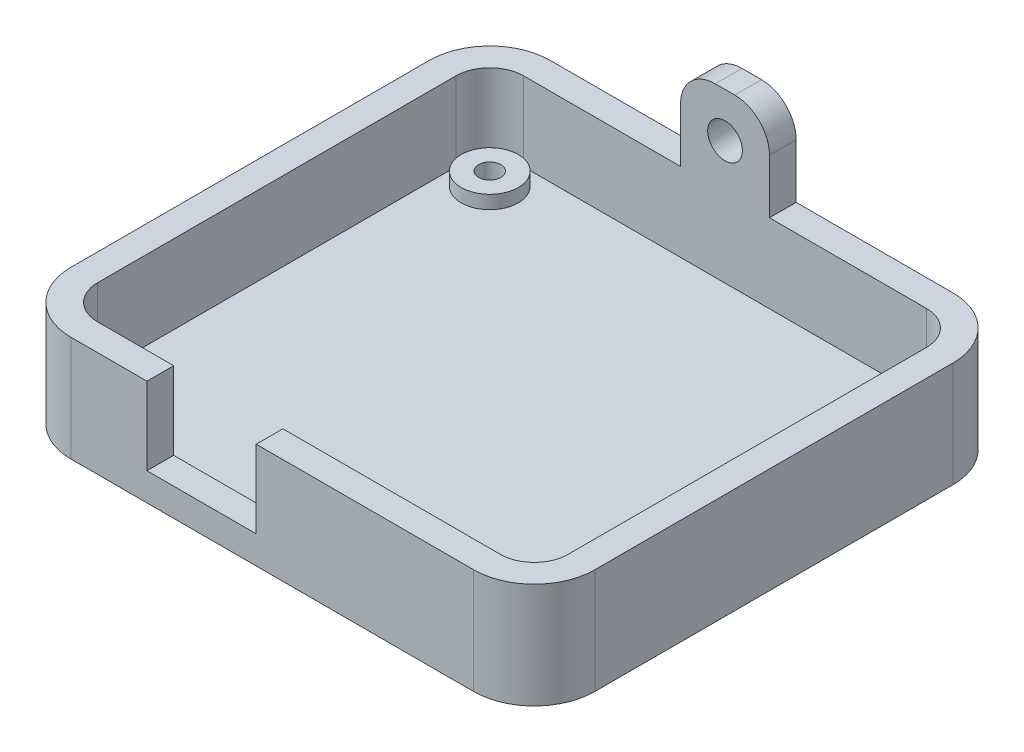
from build123d import *

# Parameters (mm, degrees)
BOSS_EXTRUDE1_DEPTH = 3
CUT_EXTRUDE1_REACH  = 77.661
SKETCH1_3_R         = 1.25
BOSS_EXTRUDE2_START = 8.86
BOSS_EXTRUDE2_DEPTH = 8.86
BOSS_EXTRUDE3_START = 1.5
SKETCH1_5_R         = 3.21
SKETCH1_5_R_2       = 1.25
BOSS_EXTRUDE3_DEPTH = 1.5
SKETCH2_W           = 12.28
SKETCH2_H           = 8.73
CUT_EXTRUDE2_DEPTH  = 3
SKETCH5_R           = 1.95
BOSS_EXTRUDE5_DEPTH = 3


with BuildPart() as part:
    # Sketch1 → Boss-Extrude1 (new body)
    with BuildSketch(Plane(origin=(0, 0, 0), x_dir=(1, 0, 0), z_dir=(0, 1, 0))):
        with BuildLine():
            Line((3.81, 3), (49.09, 3))
            ThreePointArc((49.09, 3), (53.90539718, 1.00539718), (55.9, -3.81))
            Line((55.9, -3.81), (55.9, -44.09))
            ThreePointArc((55.9, -44.09), (53.90539718, -48.90539718), (49.09, -50.9))
            Line((49.09, -50.9), (3.81, -50.9))
            ThreePointArc((3.81, -50.9), (-1.00539718, -48.90539718), (-3, -44.09))
            Line((-3, -44.09), (-3, -3.81))
            ThreePointArc((-3, -3.81), (-1.00539718, 1.00539718), (3.81, 3))
        make_face()
    extrude(amount=-BOSS_EXTRUDE1_DEPTH)

    # Sketch1<3> → Cut-Extrude1 (cut, up to next)
    with BuildSketch(Plane(origin=(0, 0, 0), x_dir=(1, 0, 0), z_dir=(0, 1, 0)), mode=Mode.PRIVATE) as cut_extrude1_sk1:
        with Locations((49.09, -44.09)):
            Circle(SKETCH1_3_R)
    cut_extrude1_tool1 = extrude(cut_extrude1_sk1.sketch, amount=-CUT_EXTRUDE1_REACH, mode=Mode.PRIVATE) & part.part
    # Sketch1<3> → Cut-Extrude1 (cut, up to next)
    with BuildSketch(Plane(origin=(0, 0, 0), x_dir=(1, 0, 0), z_dir=(0, 1, 0)), mode=Mode.PRIVATE) as cut_extrude1_sk2:
        with Locations((3.81, -44.09)):
            Circle(SKETCH1_3_R)
    cut_extrude1_tool2 = extrude(cut_extrude1_sk2.sketch, amount=-CUT_EXTRUDE1_REACH, mode=Mode.PRIVATE) & part.part
    # Sketch1<3> → Cut-Extrude1 (cut, up to next)
    with BuildSketch(Plane(origin=(0, 0, 0), x_dir=(1, 0, 0), z_dir=(0, 1, 0)), mode=Mode.PRIVATE) as cut_extrude1_sk3:
        with Locations((3.81, -3.81)):
            Circle(SKETCH1_3_R)
    cut_extrude1_tool3 = extrude(cut_extrude1_sk3.sketch, amount=-CUT_EXTRUDE1_REACH, mode=Mode.PRIVATE) & part.part
    # Sketch1<3> → Cut-Extrude1 (cut, up to next)
    with BuildSketch(Plane(origin=(0, 0, 0), x_dir=(1, 0, 0), z_dir=(0, 1, 0)), mode=Mode.PRIVATE) as cut_extrude1_sk4:
        with Locations((49.09, -3.81)):
            Circle(SKETCH1_3_R)
    cut_extrude1_tool4 = extrude(cut_extrude1_sk4.sketch, amount=-CUT_EXTRUDE1_REACH, mode=Mode.PRIVATE) & part.part
    add(cut_extrude1_tool1.solids().sort_by_distance((49.09, 0, 44.09))[0], mode=Mode.SUBTRACT)
    add(cut_extrude1_tool2.solids().sort_by_distance((3.81, 0, 44.09))[0], mode=Mode.SUBTRACT)
    add(cut_extrude1_tool3.solids().sort_by_distance((3.81, 0, 3.81))[0], mode=Mode.SUBTRACT)
    add(cut_extrude1_tool4.solids().sort_by_distance((49.09, 0, 3.81))[0], mode=Mode.SUBTRACT)

    # Sketch1<4> → Boss-Extrude2 (add)
    with BuildSketch(Plane(origin=(0, 0, 0), x_dir=(1, 0, 0), z_dir=(0, 1, 0)).offset(BOSS_EXTRUDE2_START)):
        with BuildLine():
            Line((49.09, 3), (3.81, 3))
            ThreePointArc((3.81, 3), (-1.00539718, 1.00539718), (-3, -3.81))
            Line((-3, -3.81), (-3, -44.09))
            ThreePointArc((-3, -44.09), (-1.00539718, -48.90539718), (3.81, -50.9))
            Line((3.81, -50.9), (49.09, -50.9))
            ThreePointArc((49.09, -50.9), (53.90539718, -48.90539718), (55.9, -44.09))
            Line((55.9, -44.09), (55.9, -3.81))
            ThreePointArc((55.9, -3.81), (53.90539718, 1.00539718), (49.09, 3))
        make_face()
        with BuildLine():
            ThreePointArc((0, -3.81), (1.115923164, -1.115923164), (3.81, 0))
            Line((3.81, 0), (49.09, 0))
            ThreePointArc((49.09, 0), (51.784076836, -1.115923164), (52.9, -3.81))
            Line((52.9, -3.81), (52.9, -44.09))
            ThreePointArc((52.9, -44.09), (51.784076836, -46.784076836), (49.09, -47.9))
            Line((49.09, -47.9), (3.81, -47.9))
            ThreePointArc((3.81, -47.9), (1.115923164, -46.784076836), (0, -44.09))
            Line((0, -44.09), (0, -3.81))
        make_face(mode=Mode.SUBTRACT)
    extrude(amount=-BOSS_EXTRUDE2_DEPTH)

    # Sketch1<5> → Boss-Extrude3 (add)
    # profile 1 of 4: a face of its own
    with BuildSketch(Plane(origin=(0, 0, 0), x_dir=(1, 0, 0), z_dir=(0, 1, 0)).offset(BOSS_EXTRUDE3_START)):
        with Locations((3.81, -3.81)):
            Circle(SKETCH1_5_R)
        with Locations((3.81, -3.81)):
            Circle(SKETCH1_5_R_2, mode=Mode.SUBTRACT)
    # profile 2 of 4: a face of its own
    with BuildSketch(Plane(origin=(0, 0, 0), x_dir=(1, 0, 0), z_dir=(0, 1, 0)).offset(BOSS_EXTRUDE3_START)):
        with Locations((49.09, -3.81)):
            Circle(SKETCH1_5_R)
        with Locations((49.09, -3.81)):
            Circle(SKETCH1_5_R_2, mode=Mode.SUBTRACT)
    # profile 3 of 4: a face of its own
    with BuildSketch(Plane(origin=(0, 0, 0), x_dir=(1, 0, 0), z_dir=(0, 1, 0)).offset(BOSS_EXTRUDE3_START)):
        with Locations((49.09, -44.09)):
            Circle(SKETCH1_5_R)
        with Locations((49.09, -44.09)):
            Circle(SKETCH1_5_R_2, mode=Mode.SUBTRACT)
    # profile 4 of 4: a face of its own
    with BuildSketch(Plane(origin=(0, 0, 0), x_dir=(1, 0, 0), z_dir=(0, 1, 0)).offset(BOSS_EXTRUDE3_START)):
        with Locations((3.81, -44.09)):
            Circle(SKETCH1_5_R)
        with Locations((3.81, -44.09)):
            Circle(SKETCH1_5_R_2, mode=Mode.SUBTRACT)
    extrude(amount=-BOSS_EXTRUDE3_DEPTH)

    # Sketch2 → Cut-Extrude2 (cut)
    with BuildSketch(Plane.XY.offset(50.9)):
        with Locations((18.5, 4.5)):
            Rectangle(SKETCH2_W, SKETCH2_H)
    extrude(amount=-CUT_EXTRUDE2_DEPTH, mode=Mode.SUBTRACT)

    # Sketch5 → Boss-Extrude5 (add)
    with BuildSketch(Plane(origin=(0, 0, -3), x_dir=(-1, 0, 0), z_dir=(0, 0, -1))):
        with BuildLine():
            Line((-31.45, 8.86), (-21.45, 8.86))
            Line((-21.45, 8.86), (-21.45, 14.96))
            ThreePointArc((-21.45, 14.96), (-22.592283553, 17.717716447), (-25.35, 18.86))
            Line((-25.35, 18.86), (-27.55, 18.86))
            ThreePointArc((-27.55, 18.86), (-30.307716447, 17.717716447), (-31.45, 14.96))
            Line((-31.45, 14.96), (-31.45, 8.86))
        make_face()
        with Locations((-26.45, 13.86)):
            Circle(SKETCH5_R, mode=Mode.SUBTRACT)
    extrude(amount=-BOSS_EXTRUDE5_DEPTH)


solid = part.part
